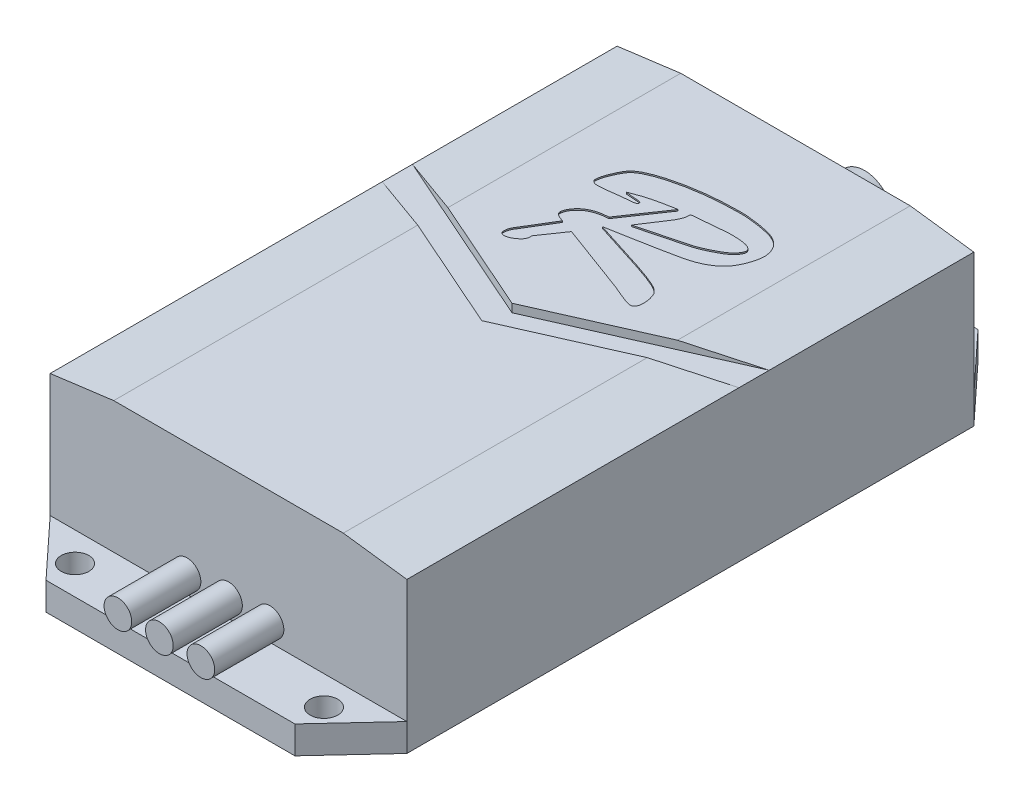
from build123d import *

# Parameters (mm, degrees)
SKETCH_1_W          = 25.8
SKETCH_1_H          = 41
EXTRUDE_1_DEPTH     = 11.5
EXTRUDE_2_DEPTH     = 2
SKETCH_2_R          = 1
CUT_EXTRUDE_1_DEPTH = 30.4406182
CUT_EXTRUDE_2_DEPTH = 49.391114887
SKETCH_5_R          = 1
EXTRUDE_3_DEPTH     = 5
SKETCH_6_R          = 2.5
EXTRUDE_4_DEPTH     = 5
EXTRUDE_4_TAPER     = 5
CUT_EXTRUDE_3_DEPTH = 0.6
CUT_EXTRUDE_4_DEPTH = 0.1


with BuildPart() as part:
    # 草图1 → 凸台-拉伸1 (new body)
    with BuildSketch(Plane(origin=(0, 0, 0), x_dir=(1, 0, 0), z_dir=(0, 1, 0))):
        Rectangle(SKETCH_1_W, SKETCH_1_H)
    extrude(amount=EXTRUDE_1_DEPTH)

    # 草图1<3> → 凸台-拉伸2 (add)
    with BuildSketch(Plane(origin=(0, 0, 0), x_dir=(1, 0, 0), z_dir=(0, 1, 0))):
        Polygon((-9, 24.7), (-12.9, 20.5), (12.9, 20.5), (9, 24.7), align=None)
        Polygon((12.9, -20.5), (-12.9, -20.5), (-9, -24.7), (9, -24.7), align=None)
    extrude(amount=EXTRUDE_2_DEPTH)

    # 草图2 → 切除-拉伸1 (cut, through all)
    with BuildSketch(Plane(origin=(0, 2, 0), x_dir=(1, 0, 0), z_dir=(0, 1, 0))):
        with Locations((9, 22.6)):
            Circle(SKETCH_2_R)
        with Locations((9, -22.6)):
            Circle(SKETCH_2_R)
        with Locations((-9, -22.6)):
            Circle(SKETCH_2_R)
        with Locations((-9, 22.6)):
            Circle(SKETCH_2_R)
    extrude(amount=-CUT_EXTRUDE_1_DEPTH, mode=Mode.SUBTRACT)

    # 草图4 → 切除-拉伸2 (cut, through all)
    with BuildSketch(Plane.XY.offset(20.5)):
        Polygon((-12.9, 10.9), (-8.3, 11.5), (-12.9, 11.5), align=None)
        Polygon((12.9, 11.5), (8.3, 11.5), (12.9, 10.9), align=None)
    extrude(amount=-CUT_EXTRUDE_2_DEPTH, mode=Mode.SUBTRACT)

    # 草图5 → 凸台-拉伸3 (add)
    with BuildSketch(Plane.XY.offset(20.5)):
        with Locations((0, 3.3)):
            Circle(SKETCH_5_R)
        with Locations((3, 3.3)):
            Circle(SKETCH_5_R)
        with Locations((-3, 3.3)):
            Circle(SKETCH_5_R)
    extrude(amount=EXTRUDE_3_DEPTH)

    # 草图6 → 凸台-拉伸4 (add)
    with BuildSketch(Plane(origin=(0, 0, -20.5), x_dir=(-1, 0, 0), z_dir=(0, 0, -1))):
        with Locations((0, 5)):
            Circle(SKETCH_6_R)
    extrude(amount=EXTRUDE_4_DEPTH, taper=EXTRUDE_4_TAPER)

    # 草图7 → 切除-拉伸3 (cut)
    with BuildSketch(Plane(origin=(0, 11.5, 0), x_dir=(1, 0, 0), z_dir=(0, 1, 0))):
        Polygon((-12.9, 5.7), (0, 0), (12.9, 5.7), (12.9, 3.51345874), (0, -2.18654126), (-12.9, 3.51345874), align=None)
    extrude(amount=-CUT_EXTRUDE_3_DEPTH, mode=Mode.SUBTRACT)

    # 草图8 → 切除-拉伸4 (cut)
    with BuildSketch(Plane(origin=(0, 11.5, 0), x_dir=(1, 0, 0), z_dir=(0, 1, 0))):
        with BuildLine():
            add(Edge.make_bspline(
                [(2.719121266, 4.765579863), (2.776388558, 4.741734121), (2.899616737, 4.69042268), (3.098661906, 4.606973782), (3.325043536, 4.510212216), (3.569843248, 4.405385113), (3.812841921, 4.303817581), (4.039236759, 4.229648491), (4.234557176, 4.174057388), (4.357058695, 4.157851949), (4.412635038, 4.150499885)],
                knots=[0, 0, 0, 0, 0.823785667, 1.77262805, 2.866182664, 4.092984974, 5.309733796, 6.360969649, 7.256406657, 8, 8, 8, 8], degree=3))
            add(Edge.make_bspline(
                [(4.412635038, 4.150499885), (4.439330897, 4.155962418), (4.491219901, 4.166579997), (4.562571074, 4.201336686), (4.623696877, 4.251649747), (4.670528858, 4.31981745), (4.710881777, 4.399049966), (4.738266635, 4.494184282), (4.752172122, 4.603319482), (4.762914637, 4.765640516), (4.753030271, 4.97263807), (4.717887747, 5.213726781), (4.6584369, 5.442059588), (4.594513137, 5.582750217), (4.562832667, 5.65247617)],
                knots=[0, 0, 0, 0, 0.577255308, 1.122016815, 1.668753728, 2.240035797, 2.866157089, 3.552752687, 4.33088317, 5.200718667, 7.008138998, 8.720841118, 10.374856384, 12, 12, 12, 12], degree=3))
            add(Edge.make_bspline(
                [(4.562832667, 5.65247617), (4.560756355, 5.670095812), (4.554805527, 5.72059471), (4.483002586, 5.797240857), (4.377661437, 5.899898042), (4.25644683, 6.008338165), (4.118256566, 6.107238775), (3.96487798, 6.189151982), (3.772543669, 6.282401822), (3.537819635, 6.38237505), (3.262355473, 6.492275392), (2.944912989, 6.611325576), (2.58576859, 6.736387532), (2.332322635, 6.822604447), (2.199196303, 6.86789119)],
                knots=[0, 0, 0, 0, 0.231299316, 0.662916999, 1.323919473, 2.215596374, 2.804616393, 3.575074996, 4.516706598, 5.639722934, 6.956985559, 8.449803223, 10.135205297, 12, 12, 12, 12], degree=3))
            Line((2.199196303, 6.86789119), (-1.488249658, 8.044050713))
            Line((-1.488249658, 8.044050713), (-1.488249658, 8.071371303))
            add(Edge.make_bspline(
                [(-1.488249658, 8.071371303), (-1.344036013, 8.096174585), (-1.060630188, 8.144917509), (-0.64542094, 8.220804565), (-0.247321496, 8.291451887), (0.132145227, 8.360531495), (0.493552624, 8.428432948), (0.837709951, 8.490803761), (1.163519205, 8.552901951), (1.472065126, 8.609558926), (1.762593652, 8.664845723), (2.034461876, 8.718576858), (2.28893056, 8.767695385), (2.524601051, 8.815311038), (2.743440396, 8.858788891), (2.943874305, 8.899524783), (3.125993489, 8.940063707), (3.343069941, 8.985747213), (3.594270709, 9.048365882), (3.879784005, 9.132344207), (4.147211599, 9.229991385), (4.398200959, 9.336155084), (4.632800937, 9.452138416), (4.848308958, 9.581975902), (5.049913088, 9.718624597), (5.171108466, 9.822596841), (5.230816856, 9.873820043)],
                knots=[0, 0, 0, 0, 1.499793203, 2.947364172, 4.326092305, 5.643821045, 6.900564163, 8.095097849, 9.228653787, 10.299996013, 11.310370504, 12.259799554, 13.140373077, 13.966647194, 14.724065134, 15.427203848, 16.062887594, 16.636322596, 17.700749009, 18.715445784, 19.68513762, 20.616924779, 21.507689989, 22.364570134, 23.194285411, 24, 24, 24, 24], degree=3))
            add(Edge.make_bspline(
                [(5.230816856, 9.873820043), (5.300000688, 9.937163635), (5.442693065, 10.067810455), (5.623731466, 10.306366699), (5.789395348, 10.57871923), (5.933403005, 10.880353381), (6.051483488, 11.197601877), (6.142159741, 11.513656944), (6.197401968, 11.82517544), (6.207864649, 12.031062519), (6.213030295, 12.132713324)],
                knots=[0, 0, 0, 0, 0.889407388, 1.834412042, 2.831331078, 3.914383449, 5.003366052, 6.043339972, 7.033955564, 8, 8, 8, 8], degree=3))
            add(Edge.make_bspline(
                [(6.213030295, 12.132713324), (6.198941205, 12.232168299), (6.171594576, 12.425208335), (6.081043668, 12.697926669), (5.952411295, 12.941955826), (5.782449559, 13.155863585), (5.573238287, 13.339579976), (5.325310265, 13.493907427), (5.039577168, 13.618820544), (4.722275315, 13.708099789), (4.393090284, 13.779183223), (4.067019337, 13.843191455), (3.750043286, 13.895080507), (3.441429736, 13.933797671), (3.141762975, 13.965212798), (2.850876183, 13.979445157), (2.56940791, 13.987221917), (2.384963375, 13.981421783), (2.294057963, 13.978563126)],
                knots=[0, 0, 0, 0, 1.006022133, 1.952668024, 2.866165338, 3.759921174, 4.677496674, 5.64555863, 6.678185303, 7.794730064, 8.945860957, 10.056543212, 11.127736693, 12.167065657, 13.176403034, 14.149257349, 15.087842196, 16, 16, 16, 16], degree=3))
            add(Edge.make_bspline(
                [(2.294057963, 13.978563126), (2.116829784, 13.975424337), (1.765531335, 13.969202687), (1.243550923, 13.945688786), (0.732267246, 13.907650477), (0.230623014, 13.858933279), (-0.260213565, 13.79525231), (-0.742161025, 13.720668569), (-1.213227476, 13.631475199), (-1.670142781, 13.532112451), (-2.101090492, 13.42288399), (-2.498300231, 13.308768969), (-2.855280348, 13.189286208), (-3.173156679, 13.064481452), (-3.452972196, 12.937571506), (-3.693141334, 12.804103221), (-3.894402849, 12.664525638), (-4.00545443, 12.559577409), (-4.057720693, 12.51018368)],
                knots=[0, 0, 0, 0, 1.284746347, 2.546600675, 3.786602507, 5.000515677, 6.199224035, 7.373606797, 8.534840937, 9.673713351, 10.762299266, 11.756609191, 12.668612524, 13.489673526, 14.231017365, 14.893754969, 15.479347409, 16, 16, 16, 16], degree=3))
            add(Edge.make_bspline(
                [(-4.057720693, 12.51018368), (-4.096300012, 12.457496072), (-4.178169442, 12.345687351), (-4.28719045, 12.151745408), (-4.402075932, 11.930567901), (-4.509242708, 11.68485839), (-4.609945267, 11.437266137), (-4.681194864, 11.199920518), (-4.735683617, 10.986063224), (-4.747731379, 10.849046652), (-4.753372867, 10.784887237)],
                knots=[0, 0, 0, 0, 0.833175232, 1.768086704, 2.836549525, 4.015227534, 5.189936514, 6.246276997, 7.178801216, 8, 8, 8, 8], degree=3))
            add(Edge.make_bspline(
                [(-4.753372867, 10.784887237), (-4.750558223, 10.755452982), (-4.745228465, 10.69971681), (-4.709188672, 10.625304802), (-4.65644892, 10.565035463), (-4.560223622, 10.512249161), (-4.428113971, 10.469936153), (-4.31761779, 10.463796996), (-4.26325429, 10.460776565)],
                knots=[0, 0, 0, 0, 0.806174886, 1.526558196, 2.231319093, 2.969880325, 4.50919814, 6, 6, 6, 6], degree=3))
            add(Edge.make_bspline(
                [(-4.26325429, 10.460776565), (-4.159057478, 10.464561248), (-3.944159912, 10.472366853), (-3.621706095, 10.512791017), (-3.303191779, 10.559971565), (-3.093357902, 10.585074649), (-2.992503302, 10.597140201)],
                knots=[0, 0, 0, 0, 0.977991356, 2.017028729, 3.046904248, 4, 4, 4, 4], degree=3))
            Line((-2.992503302, 10.597140201), (-1.925379104, 10.707808278))
            add(Edge.make_bspline(
                [(-1.925379104, 10.707808278), (-1.902761114, 10.708972253), (-1.849771392, 10.71169923), (-1.7729497, 10.736598604), (-1.692683323, 10.77469307), (-1.674655882, 10.826449212), (-1.666416345, 10.850104628)],
                knots=[0, 0, 0, 0, 0.852648234, 1.997595373, 3.084790482, 4, 4, 4, 4], degree=3))
            add(Edge.make_bspline(
                [(-1.666416345, 10.850104628), (-1.668178535, 10.870715808), (-1.671816011, 10.913260988), (-1.724852747, 10.966407212), (-1.809634819, 10.990655131), (-1.924006114, 11.007465236), (-2.077528424, 11.016838304), (-2.275758704, 11.03116092), (-2.522175808, 11.048751881), (-2.702654336, 11.062173279), (-2.800803697, 11.069472217)],
                knots=[0, 0, 0, 0, 0.398749898, 0.823091482, 1.379884903, 2.119129554, 3.112761311, 4.419305443, 6.052716372, 8, 8, 8, 8], degree=3))
            Line((-2.800803697, 11.069472217), (-2.799637998, 11.101449814))
            add(Edge.make_bspline(
                [(-2.799637998, 11.101449814), (-2.683165224, 11.149138386), (-2.449059982, 11.244990355), (-2.091034449, 11.369813346), (-1.727231652, 11.48166624), (-1.235569853, 11.608828403), (-0.614146236, 11.743637642), (-0.11398453, 11.834395551), (0.135955196, 11.879748897)],
                knots=[0, 0, 0, 0, 0.744119806, 1.495648649, 2.24114631, 2.994187995, 4.497942128, 6, 6, 6, 6], degree=3))
            Line((0.135955196, 11.879748897), (-1.884398219, 8.904649311))
            add(Edge.make_bspline(
                [(-1.884398219, 8.904649311), (-1.96198862, 8.898961692), (-2.113087541, 8.88788567), (-2.332240238, 8.861215276), (-2.537550303, 8.821382564), (-2.729907957, 8.77034913), (-2.909389513, 8.70700481), (-3.076678695, 8.634490682), (-3.229201874, 8.549112698), (-3.410649879, 8.424508757), (-3.605834058, 8.251486014), (-3.791231789, 8.019124897), (-3.927259791, 7.767884377), (-3.968164666, 7.586665223), (-3.988550732, 7.496349688)],
                knots=[0, 0, 0, 0, 1.022192398, 1.990609226, 2.898818929, 3.768079845, 4.603048919, 5.397554874, 6.160944354, 6.895625769, 8.28728875, 9.568829666, 10.788359578, 12, 12, 12, 12], degree=3))
            add(Edge.make_bspline(
                [(-3.988550732, 7.496349688), (-3.988596788, 7.462834126), (-3.988687608, 7.396741962), (-3.940532707, 7.305094563), (-3.866778726, 7.222977847), (-3.727161802, 7.139008064), (-3.548831349, 7.055037847), (-3.400188431, 7.010654546), (-3.33242425, 6.990420834)],
                knots=[0, 0, 0, 0, 0.666720825, 1.314763033, 2.03006263, 2.874284598, 4.575031036, 6, 6, 6, 6], degree=3))
            Line((-3.33242425, 6.990420834), (-4.602796965, 4.902182815))
            add(Edge.make_bspline(
                [(-4.602796965, 4.902182815), (-4.636897636, 4.850850261), (-4.704043028, 4.749774702), (-4.774437302, 4.58350381), (-4.822659211, 4.410663824), (-4.831761849, 4.291793789), (-4.836376819, 4.231527553)],
                knots=[0, 0, 0, 0, 1.024820769, 2.017907244, 2.995093523, 4, 4, 4, 4], degree=3))
            add(Edge.make_bspline(
                [(-4.836376819, 4.231527553), (-4.831635207, 4.190523928), (-4.822382131, 4.110506911), (-4.743545249, 4.016458724), (-4.640383553, 3.956300279), (-4.56181875, 3.948769131), (-4.52214757, 3.944966288)],
                knots=[0, 0, 0, 0, 1.030439607, 2.010863724, 2.995588596, 4, 4, 4, 4], degree=3))
            add(Edge.make_bspline(
                [(-4.52214757, 3.944966288), (-4.466973224, 3.951350456), (-4.351143279, 3.964753021), (-4.177604017, 4.031817412), (-3.995248728, 4.126802173), (-3.814890215, 4.252870444), (-3.652924608, 4.397260321), (-3.541114924, 4.565081958), (-3.487977461, 4.74746041), (-3.502827511, 4.868388169), (-3.510289863, 4.929156012)],
                knots=[0, 0, 0, 0, 0.849999095, 1.784440668, 2.834333957, 4.004700562, 5.157086222, 6.144939471, 7.067806859, 8, 8, 8, 8], degree=3))
            Line((-3.510289863, 4.929156012), (-2.335187961, 6.637040306))
            Line((-2.335187961, 6.637040306), (2.719121266, 4.765579863))
        make_face()
        with BuildLine():
            add(Edge.make_bspline(
                [(0.437851966, 10.759755227), (0.499466507, 10.850839261), (0.621875221, 11.031794588), (0.752711008, 11.272431686), (0.839435822, 11.47444077), (0.885332612, 11.638984718), (0.910674656, 11.81569756), (0.913275023, 11.937638263), (0.914611323, 12.000302257)],
                knots=[0, 0, 0, 0, 1.461429761, 2.903401301, 3.633675665, 4.379538176, 5.167262399, 6, 6, 6, 6], degree=3))
            Line((0.914611323, 12.000302257), (3.443116912, 12.225594839))
            add(Edge.make_bspline(
                [(3.443116912, 12.225594839), (3.50211109, 12.228980552), (3.636779351, 12.236709248), (3.862792214, 12.230031117), (4.137063583, 12.214469487), (4.390150373, 12.189811995), (4.600730923, 12.161519625), (4.746172686, 12.129945297), (4.872877103, 12.091198592), (4.981490659, 12.044636305), (5.07003704, 11.987179036), (5.138781906, 11.920618947), (5.191296505, 11.846720573), (5.208485395, 11.790795251), (5.216982864, 11.763148107)],
                knots=[0, 0, 0, 0, 1.098135831, 2.506756574, 4.199683403, 6.205542566, 7.232614543, 8.147869649, 8.969059782, 9.692774973, 10.338159444, 10.918440969, 11.465322364, 12, 12, 12, 12], degree=3))
            add(Edge.make_bspline(
                [(5.216982864, 11.763148107), (5.20676136, 11.715220625), (5.185869819, 11.617262553), (5.122139331, 11.476038707), (5.033982797, 11.339080905), (4.921278071, 11.206176315), (4.786221262, 11.07503928), (4.624804733, 10.948701438), (4.43794526, 10.827146496), (4.23287247, 10.709378378), (4.020324411, 10.601790569), (3.816208619, 10.49748179), (3.623294019, 10.404899767), (3.441650121, 10.323214951), (3.270733404, 10.254909231), (3.113500615, 10.192568462), (2.96724924, 10.142416648), (2.872594121, 10.1170762), (2.827654801, 10.10504534)],
                knots=[0, 0, 0, 0, 0.77622208, 1.586505629, 2.442417748, 3.35570827, 4.346830449, 5.426538921, 6.604276827, 7.883396778, 9.179170205, 10.385947116, 11.522708019, 12.576160747, 13.547269456, 14.444610298, 15.261549128, 16, 16, 16, 16], degree=3))
            Line((2.827654801, 10.10504534), (-0.573009879, 9.218836101))
            Line((-0.573009879, 9.218836101), (0.437851966, 10.759755227))
        make_face(mode=Mode.SUBTRACT)
    extrude(amount=-CUT_EXTRUDE_4_DEPTH, mode=Mode.SUBTRACT)


solid = part.part
